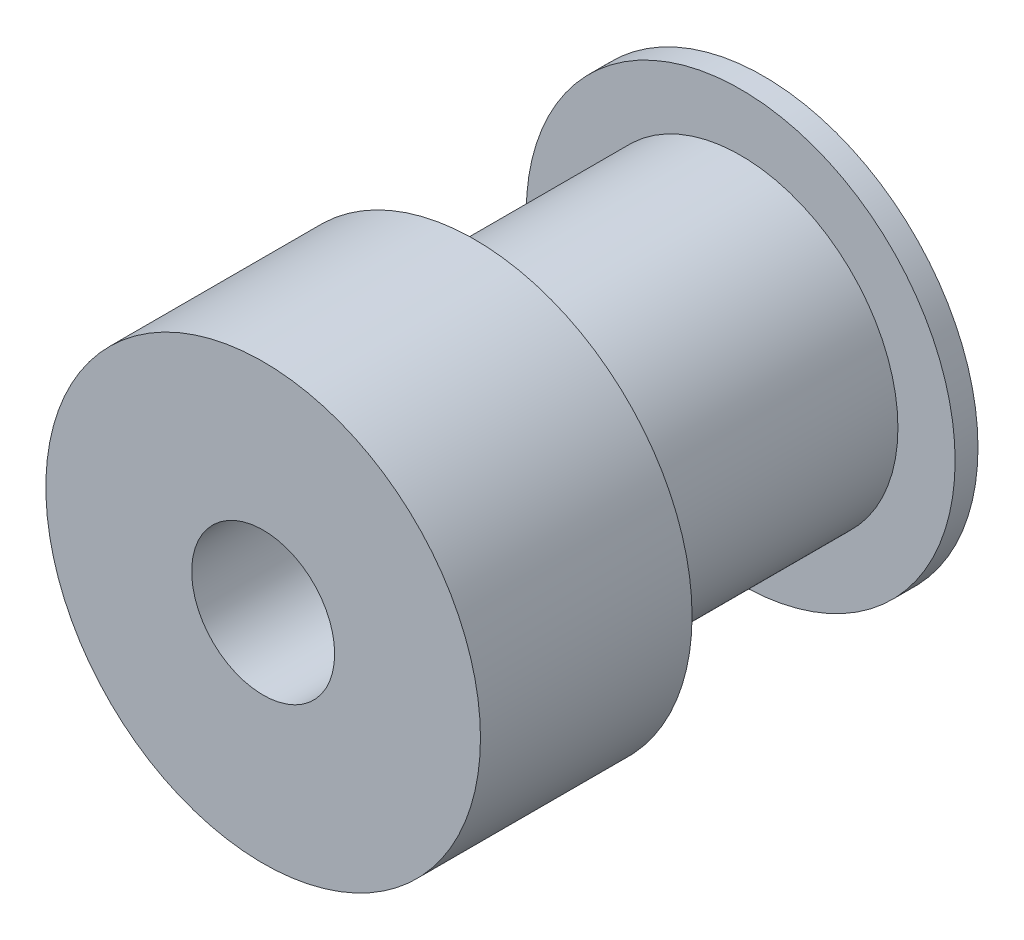
from build123d import *

# Parameters (mm, degrees)
SKETCH_1_R          = 7.5
EXTRUDE_1_DEPTH     = 0.8
SKETCH_2_R          = 5.5
EXTRUDE_2_DEPTH     = 9.3
SKETCH_3_R          = 7.6
EXTRUDE_3_DEPTH     = 7.4
SKETCH_4_R          = 2.5
CUT_EXTRUDE_1_DEPTH = 21.537039709


with BuildPart() as part:
    # Эскиз1 → Бобышка-Вытянуть1 (new body)
    with BuildSketch(Plane.XY):
        Circle(SKETCH_1_R)
    extrude(amount=EXTRUDE_1_DEPTH)

    # Эскиз2 → Бобышка-Вытянуть2 (add)
    with BuildSketch(Plane.XY.offset(0.8)):
        Circle(SKETCH_2_R)
    extrude(amount=EXTRUDE_2_DEPTH)

    # Эскиз3 → Бобышка-Вытянуть3 (add)
    with BuildSketch(Plane.XY.offset(10.1)):
        Circle(SKETCH_3_R)
    extrude(amount=EXTRUDE_3_DEPTH)

    # Эскиз4 → Вырез-Вытянуть1 (cut, through all)
    with BuildSketch(Plane.XY.offset(17.5)):
        Circle(SKETCH_4_R)
    extrude(amount=-CUT_EXTRUDE_1_DEPTH, mode=Mode.SUBTRACT)


solid = part.part
